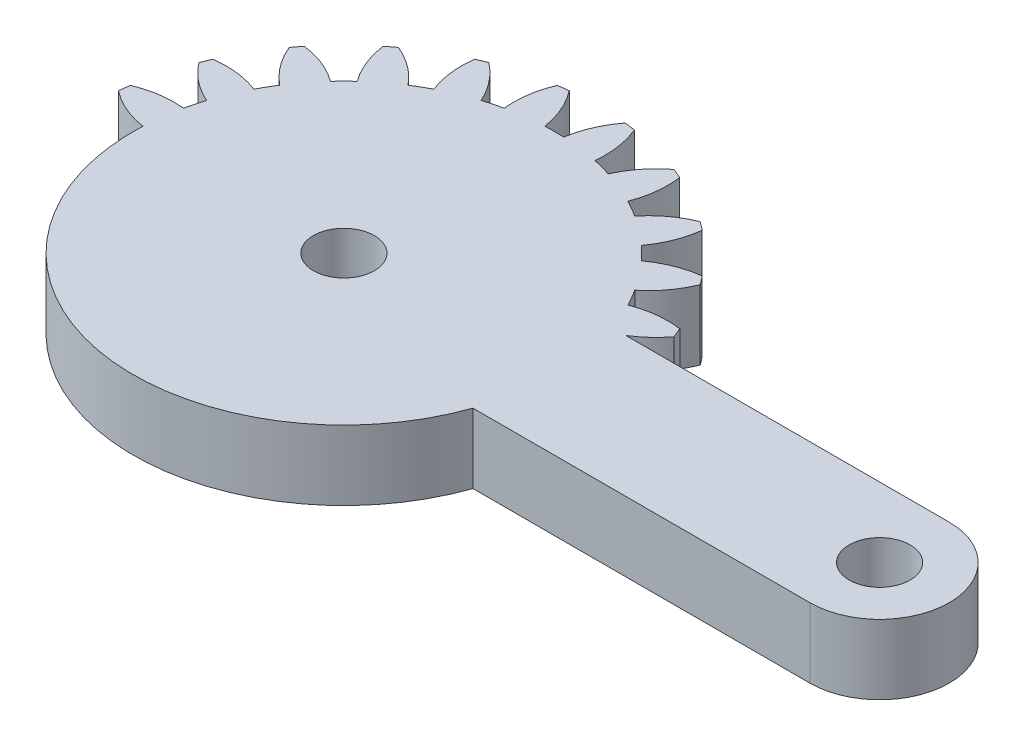
from build123d import *

# Parameters (mm, degrees)
SKETCH1_R           = 1.75
BOSS_EXTRUDE1_DEPTH = 4
BOSS_EXTRUDE2_START = -4
BOSS_EXTRUDE2_DEPTH = 4


with BuildPart() as part:
    # Sketch1 → Boss-Extrude1 (new body)
    with BuildSketch(Plane(origin=(0, 0, 0), x_dir=(1, 0, 0), z_dir=(0, 1, 0))):
        with BuildLine():
            Line((30.75, 4), (11.409123542, 4))
            ThreePointArc((11.409123542, 4), (-12.09, 0), (11.409123542, -4))
            Line((11.409123542, -4), (30.75, -4))
            ThreePointArc((30.75, -4), (34.75, 0), (30.75, 4))
        make_face()
        with Locations(Location((30.75, 0, 0), (0, 0, 270))):
            Circle(SKETCH1_R, mode=Mode.SUBTRACT)
        with Locations(Location((0, 0, 0), (0, 0, 270))):
            Circle(SKETCH1_R, mode=Mode.SUBTRACT)
    extrude(amount=BOSS_EXTRUDE1_DEPTH)

    # Sketch2 → Boss-Extrude2 (add)
    with BuildSketch(Plane(origin=(0, 4, 0), x_dir=(1, 0, 0), z_dir=(0, 1, 0)).offset(BOSS_EXTRUDE2_START)):
        with BuildLine():
            ThreePointArc((13.631289382, 5.312706446), (13.515656169, 5.600351625), (13.393953907, 5.885482032))
            ThreePointArc((13.393953907, 5.885482032), (12.042056289, 5.896469103), (10.729798038, 5.571313495))
            ThreePointArc((10.729798038, 5.571313495), (11.16927846, 4.627668819), (11.525956115, 3.649717201))
            ThreePointArc((11.525956115, 3.649717201), (12.683545875, 4.348379847), (13.631289382, 5.312706446))
        make_face()
        with BuildLine():
            ThreePointArc((0.54, 12.077934426), (0.914536108, 13.376961211), (1.6, 14.542245356))
            ThreePointArc((1.6, 14.542245356), (1.907781307, 14.505077404), (2.214705946, 14.461396114))
            ThreePointArc((2.214705946, 14.461396114), (2.575965524, 13.158462861), (2.602230245, 11.806629399))
            ThreePointArc((2.602230245, 11.806629399), (1.576960473, 11.986713297), (0.54, 12.077934426))
        make_face()
        with BuildLine():
            ThreePointArc((5.882126404, 13.395427913), (5.89385242, 12.043390174), (5.569341946, 10.73082151))
            ThreePointArc((5.569341946, 10.73082151), (4.625616537, 11.170128542), (3.647599401, 11.526626506))
            ThreePointArc((3.647599401, 11.526626506), (4.345586373, 12.684452949), (5.309291379, 13.63261989))
            ThreePointArc((5.309291379, 13.63261989), (5.596965518, 13.51705874), (5.882126404, 13.395427913))
        make_face()
        with BuildLine():
            ThreePointArc((9.148689668, 11.416583436), (8.810083014, 10.10758035), (8.156912198, 8.92372587))
            ThreePointArc((8.156912198, 8.92372587), (7.359044479, 9.592317987), (6.506620931, 10.189798038))
            ThreePointArc((6.506620931, 10.189798038), (7.480492108, 11.12752018), (8.656763324, 11.793953907))
            ThreePointArc((8.656763324, 11.793953907), (8.904725778, 11.607874862), (9.148689668, 11.416583436))
        make_face()
        with BuildLine():
            ThreePointArc((11.791784851, 8.659717665), (11.125921009, 7.482955629), (10.188602363, 6.508493058))
            ThreePointArc((10.188602363, 6.508493058), (9.5909657, 7.360806813), (8.922226997, 8.158551674))
            ThreePointArc((8.922226997, 8.158551674), (10.105614668, 8.8122653), (11.414291155, 9.151549455))
            ThreePointArc((11.414291155, 9.151549455), (11.605643693, 8.907633495), (11.791784851, 8.659717665))
        make_face()
        with BuildLine():
            ThreePointArc((-1.603643062, 14.541844069), (-1.911415048, 14.504599013), (-2.218328735, 14.460840834))
            ThreePointArc((-2.218328735, 14.460840834), (-2.578838281, 13.157851673), (-2.604399509, 11.806151075))
            ThreePointArc((-2.604399509, 11.806151075), (-1.579162842, 11.98642335), (-0.542219148, 12.077835005))
            ThreePointArc((-0.542219148, 12.077835005), (-0.917469165, 13.376808049), (-1.603643062, 14.541844069))
        make_face()
        with BuildLine():
            ThreePointArc((-5.312706446, 13.631289382), (-5.600351625, 13.515656169), (-5.885482032, 13.393953907))
            ThreePointArc((-5.885482032, 13.393953907), (-5.896469103, 12.042056289), (-5.571313495, 10.729798038))
            ThreePointArc((-5.571313495, 10.729798038), (-4.627668819, 11.16927846), (-3.649717201, 11.525956115))
            ThreePointArc((-3.649717201, 11.525956115), (-4.348379847, 12.683545875), (-5.312706446, 13.631289382))
        make_face()
        with BuildLine():
            ThreePointArc((-8.659717665, 11.791784851), (-8.907633495, 11.605643693), (-9.151549455, 11.414291155))
            ThreePointArc((-9.151549455, 11.414291155), (-8.8122653, 10.105614668), (-8.158551674, 8.922226997))
            ThreePointArc((-8.158551674, 8.922226997), (-7.360806813, 9.5909657), (-6.508493058, 10.188602363))
            ThreePointArc((-6.508493058, 10.188602363), (-7.482955629, 11.125921009), (-8.659717665, 11.791784851))
        make_face()
        with BuildLine():
            ThreePointArc((-11.416583436, 9.148689668), (-11.607874862, 8.904725778), (-11.793953907, 8.656763324))
            ThreePointArc((-11.793953907, 8.656763324), (-11.12752018, 7.480492108), (-10.189798038, 6.506620931))
            ThreePointArc((-10.189798038, 6.506620931), (-9.592317987, 7.359044479), (-8.92372587, 8.156912198))
            ThreePointArc((-8.92372587, 8.156912198), (-10.10758035, 8.810083014), (-11.416583436, 9.148689668))
        make_face()
        with BuildLine():
            ThreePointArc((-13.395427913, 5.882126404), (-13.51705874, 5.596965518), (-13.63261989, 5.309291379))
            ThreePointArc((-13.63261989, 5.309291379), (-12.684452949, 4.345586373), (-11.526626506, 3.647599401))
            ThreePointArc((-11.526626506, 3.647599401), (-11.170128542, 4.625616537), (-10.73082151, 5.569341946))
            ThreePointArc((-10.73082151, 5.569341946), (-12.043390174, 5.89385242), (-13.395427913, 5.882126404))
        make_face()
        with BuildLine():
            ThreePointArc((-14.461396114, 2.214705946), (-14.505077404, 1.907781307), (-14.542245356, 1.6))
            ThreePointArc((-14.542245356, 1.6), (-13.376961211, 0.914536108), (-12.077934426, 0.54))
            ThreePointArc((-12.077934426, 0.54), (-11.986713297, 1.576960473), (-11.806629399, 2.602230245))
            ThreePointArc((-11.806629399, 2.602230245), (-13.158462861, 2.575965524), (-14.461396114, 2.214705946))
        make_face()
    extrude(amount=BOSS_EXTRUDE2_DEPTH)


solid = part.part
